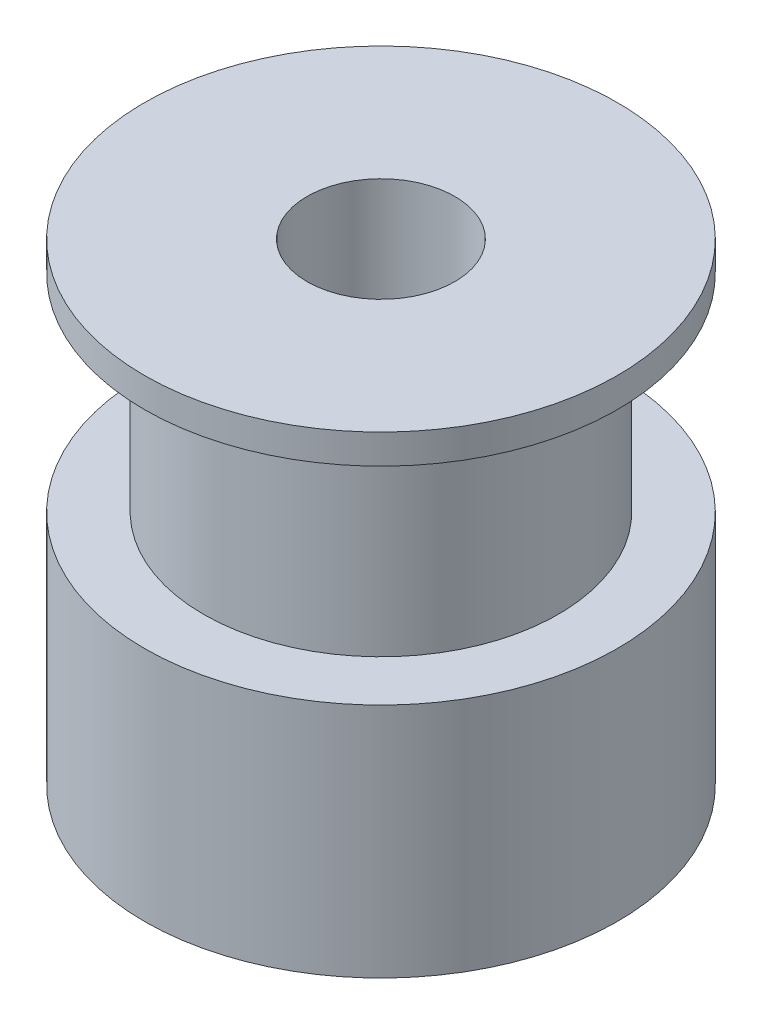
from build123d import *

# Parameters (mm, degrees)
SKETCH_1_R      = 8
SKETCH_1_R_2    = 2.5
EXTRUDE_1_DEPTH = 8
SKETCH_2_R      = 6
SKETCH_2_R_2    = 2.5
EXTRUDE_2_DEPTH = 7
SKETCH_3_R      = 8
SKETCH_3_R_2    = 2.5
EXTRUDE_3_DEPTH = 1


with BuildPart() as part:
    # 草图1 → 凸台-拉伸1 (new body)
    with BuildSketch(Plane(origin=(0, 0, 0), x_dir=(1, 0, 0), z_dir=(0, 1, 0))):
        with Locations(Location((0, 0, 0), (0, 0, 270))):
            Circle(SKETCH_1_R)
        with Locations(Location((0, 0, 0), (0, 0, 270))):
            Circle(SKETCH_1_R_2, mode=Mode.SUBTRACT)
    extrude(amount=EXTRUDE_1_DEPTH)

    # 草图2 → 凸台-拉伸2 (add)
    with BuildSketch(Plane(origin=(0, 8, 0), x_dir=(1, 0, 0), z_dir=(0, 1, 0))):
        with Locations(Location((0, 0, 0), (0, 0, 270))):
            Circle(SKETCH_2_R)
        with Locations(Location((0, 0, 0), (0, 0, 270))):
            Circle(SKETCH_2_R_2, mode=Mode.SUBTRACT)
    extrude(amount=EXTRUDE_2_DEPTH)

    # 草图3 → 凸台-拉伸3 (add)
    with BuildSketch(Plane(origin=(0, 15, 0), x_dir=(1, 0, 0), z_dir=(0, 1, 0))):
        with Locations(Location((0, 0, 0), (0, 0, 270))):
            Circle(SKETCH_3_R)
        with Locations(Location((0, 0, 0), (0, 0, 270))):
            Circle(SKETCH_3_R_2, mode=Mode.SUBTRACT)
    extrude(amount=EXTRUDE_3_DEPTH)


solid = part.part
